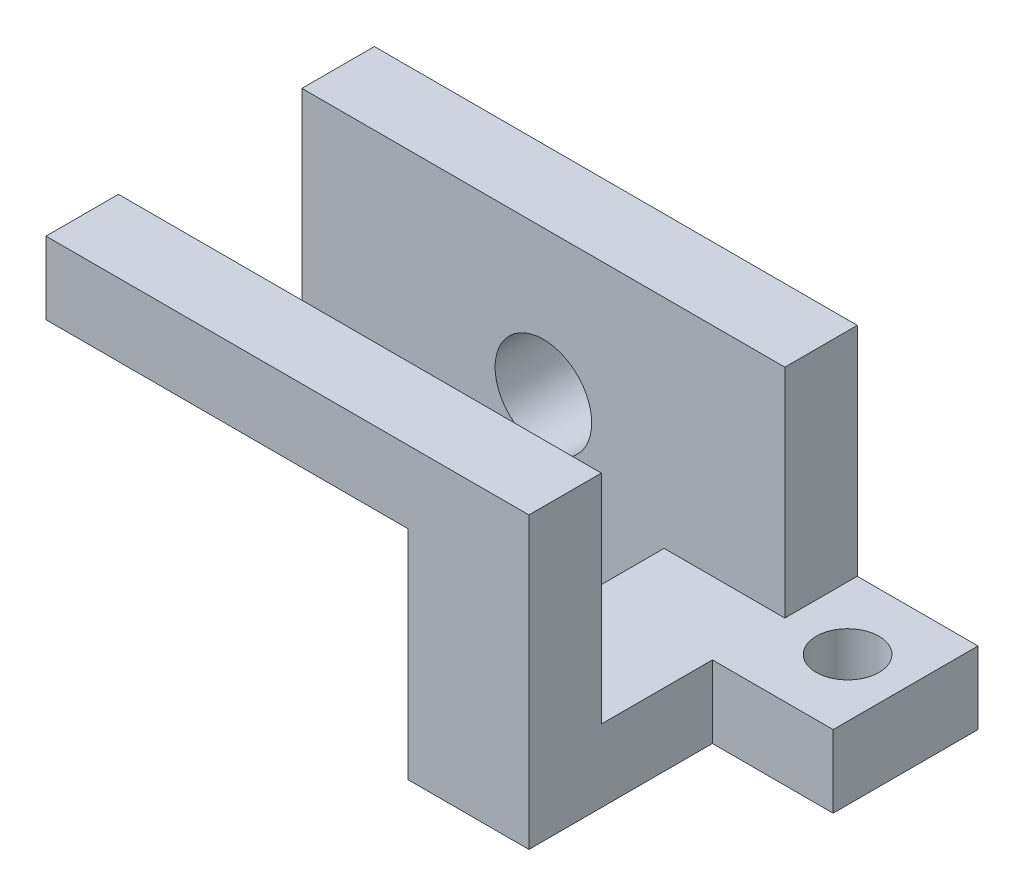
from build123d import *

# Parameters (mm, degrees)
BOSS_EXTRUDE1_START = -15
SKETCH1_W           = 125
SKETCH1_H           = 60
BOSS_EXTRUDE1_DEPTH = 68
SKETCH2_W           = 38
SKETCH2_H           = 45
CUT_EXTRUDE1_DEPTH  = 140.046754727
SKETCH3_W           = 25
SKETCH3_H           = 30
CUT_EXTRUDE2_DEPTH  = 45
SKETCH4_W           = 25
SKETCH4_H           = 38
CUT_EXTRUDE3_DEPTH  = 110.69958979
CUT_EXTRUDE4_START  = -53
SKETCH5_W           = 75
SKETCH5_H           = 45
CUT_EXTRUDE4_DEPTH  = 53
HOLE1_D             = 13
HOLE2_D             = 20


with BuildPart() as part:
    # Sketch1 → Boss-Extrude1 (new body)
    with BuildSketch(Plane.XY.offset(BOSS_EXTRUDE1_START)):
        with Locations((12.5, 0)):
            Rectangle(SKETCH1_W, SKETCH1_H)
    extrude(amount=BOSS_EXTRUDE1_DEPTH)

    # Sketch2 → Cut-Extrude1 (cut, through all)
    with BuildSketch(Plane(origin=(75, 0, 0), x_dir=(0, 0, -1), z_dir=(1, 0, 0))):
        with Locations((-19, 7.5)):
            Rectangle(SKETCH2_W, SKETCH2_H)
    extrude(amount=-CUT_EXTRUDE1_DEPTH, mode=Mode.SUBTRACT)

    # Sketch3 → Cut-Extrude2 (cut)
    with BuildSketch(Plane(origin=(0, 30, 0), x_dir=(1, 0, 0), z_dir=(0, 1, 0))):
        with Locations((62.5, 0)):
            Rectangle(SKETCH3_W, SKETCH3_H)
    extrude(amount=-CUT_EXTRUDE2_DEPTH, mode=Mode.SUBTRACT)

    # Sketch4 → Cut-Extrude3 (cut, through all)
    with BuildSketch(Plane(origin=(0, 30, 0), x_dir=(1, 0, 0), z_dir=(0, 1, 0))):
        with Locations((62.5, -34)):
            Rectangle(SKETCH4_W, SKETCH4_H)
    extrude(amount=-CUT_EXTRUDE3_DEPTH, mode=Mode.SUBTRACT)

    # Sketch5 → Cut-Extrude4 (cut)
    with BuildSketch(Plane.XY.offset(53).offset(CUT_EXTRUDE4_START)):
        with Locations((-12.5, -7.5)):
            Rectangle(SKETCH5_W, SKETCH5_H)
    extrude(amount=CUT_EXTRUDE4_DEPTH, mode=Mode.SUBTRACT)

    # Hole1 (through all)
    with Locations(Plane(origin=(0, -15, 0), x_dir=(1, 0, 0), z_dir=(0, 1, 0))):
        with Locations((63, 0)):
            Hole(HOLE1_D / 2)

    # Hole2 (through all)
    with Locations(Plane.XY):
        with Locations((0, 0)):
            Hole(HOLE2_D / 2)


solid = part.part
